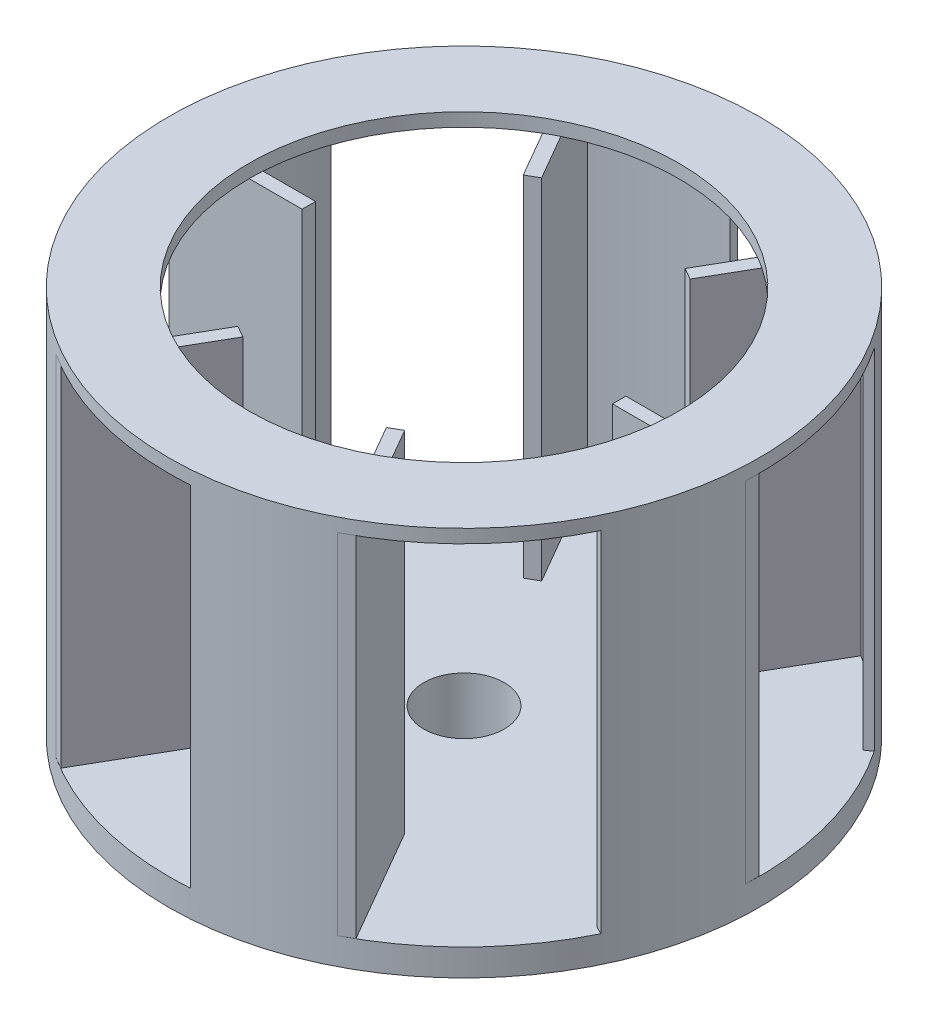
from build123d import *
from build123d.topology import SkipClean

# Parameters (mm, degrees)
BOSS_EXTRUDE1_START = 92.075
SKETCH1_R           = 139.7
BOSS_EXTRUDE1_DEPTH = 6.35
BOSS_EXTRUDE2_START = -92.075
SKETCH2_R           = 139.7
BOSS_EXTRUDE2_DEPTH = 12.7
BOSS_EXTRUDE3_START = 165.1
BOSS_EXTRUDE3_DEPTH = 165.1
CIRPATTERN1_COUNT   = 6
SKETCH8_R           = 38.1
BOSS_EXTRUDE4_DEPTH = 63.5
SKETCH9_R           = 19.05
CUT_EXTRUDE1_DEPTH  = 76.2
SKETCH10_R          = 101.6
CUT_EXTRUDE2_DEPTH  = 6.35


with BuildPart() as part:
    # Sketch1 → Boss-Extrude1 (new body)
    with BuildSketch(Plane(origin=(0, 0, 0), x_dir=(1, 0, 0), z_dir=(0, 1, 0)).offset(BOSS_EXTRUDE1_START)):
        with Locations(Location((0, 0, 0), (0, 0, 270))):
            Circle(SKETCH1_R)
    extrude(amount=-BOSS_EXTRUDE1_DEPTH)



with BuildPart() as body_2:
    # Sketch2 → Boss-Extrude2 (new body)
    with BuildSketch(Plane(origin=(0, 0, 0), x_dir=(1, 0, 0), z_dir=(0, 1, 0)).offset(BOSS_EXTRUDE2_START)):
        with Locations(Location((0, 0, 0), (0, 0, 270))):
            Circle(SKETCH2_R)
    extrude(amount=BOSS_EXTRUDE2_DEPTH)


with BuildPart() as part_1:
    add(part.part)

    add(body_2.part)  # Boss-Extrude3 merges body 2
    # Sketch3 → Boss-Extrude3 (add)
    with BuildSketch(Plane(origin=(0, -79.375, 0), x_dir=(1, 0, 0), z_dir=(0, 1, 0)).offset(BOSS_EXTRUDE3_START)):
        with BuildLine():
            Line((122.269799969, -59.297454545), (125.697925202, -60.96))
            ThreePointArc((125.697925202, -60.96), (135.408353278, -34.360847815), (139.555607197, -6.35))
            Line((139.555607197, -6.35), (139.555607197, 0))
            Line((139.555607197, 0), (76.563607197, 0))
            Line((76.563607197, 0), (76.563607197, -6.35))
            Line((76.563607197, -6.35), (135.741554433, -6.35))
            ThreePointArc((135.741554433, -6.35), (131.694050685, -33.507747077), (122.269799969, -59.297454545))
        make_face()
    boss_extrude3 = extrude(amount=-BOSS_EXTRUDE3_DEPTH)

    # CirPattern1: Boss-Extrude3 ×6 about axis
    with SkipClean():  # the faces are left unmerged after this step: merging them gives an invalid solid
        cirpattern1_axis = Axis((0, 0, 0), (0, 1, 0))
        for i in range(1, CIRPATTERN1_COUNT):
            add(boss_extrude3.rotate(cirpattern1_axis, i * 360 / CIRPATTERN1_COUNT))

    # Sketch8 → Boss-Extrude4 (add)
    with SkipClean():  # the faces are left unmerged after this step: merging them gives an invalid solid
        with BuildSketch(Plane.XZ.offset(92.075)):
            with Locations(Location((0, 0, 0), (0, 0, 270))):
                Circle(SKETCH8_R)
        extrude(amount=BOSS_EXTRUDE4_DEPTH)

    # Sketch9 → Cut-Extrude1 (cut)
    with SkipClean():  # the faces are left unmerged after this step: merging them gives an invalid solid
        with BuildSketch(Plane.XZ.offset(155.575)):
            with Locations(Location((0, 0, 0), (0, 0, 270))):
                Circle(SKETCH9_R)
        extrude(amount=-CUT_EXTRUDE1_DEPTH, mode=Mode.SUBTRACT)

    # Sketch10 → Cut-Extrude2 (cut)
    with SkipClean():  # the faces are left unmerged after this step: merging them gives an invalid solid
        with BuildSketch(Plane(origin=(0, 92.075, 0), x_dir=(1, 0, 0), z_dir=(0, 1, 0))):
            with Locations(Location((0, 0, 0), (0, 0, 270))):
                Circle(SKETCH10_R)
        extrude(amount=-CUT_EXTRUDE2_DEPTH, mode=Mode.SUBTRACT)


solid = part_1.part
